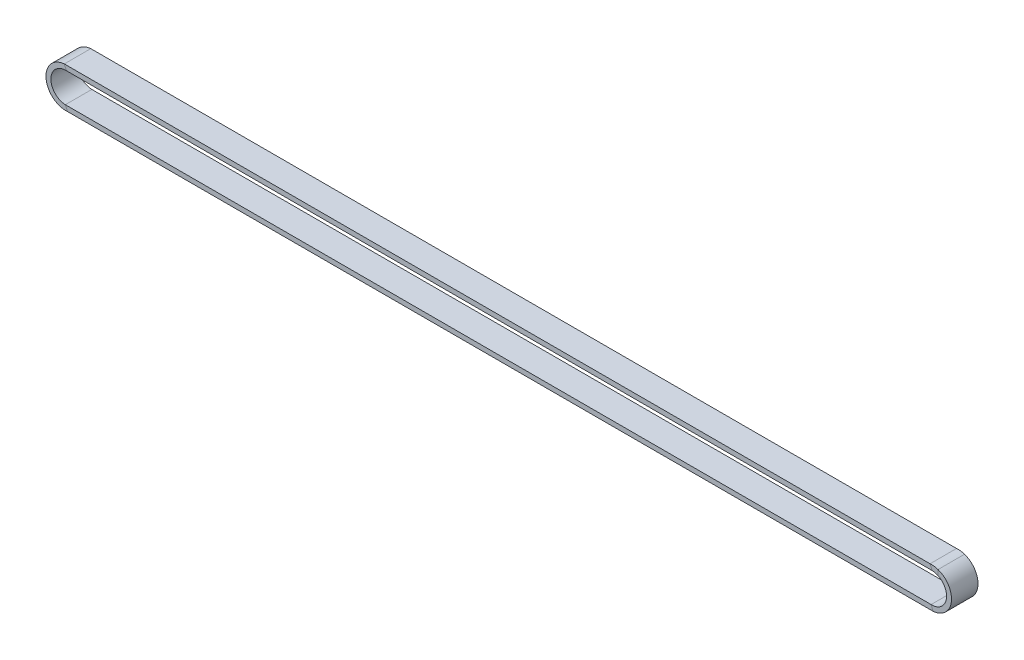
from build123d import *

# Parameters (mm, degrees)
SKETCH3_W = 10
SKETCH3_H = 2


with BuildPart() as part:
    # Sweep1: sweep along a path in Sketch2
    with BuildLine(Plane.XY) as sweep1_path:
        Line((-2.424777961, 21.387796899), (-329.424777961, 21.387796899))
        ThreePointArc((-329.424777961, 21.387796899), (-335.536981062, 27.5), (-329.424777961, 33.612203101))
        Line((-329.424777961, 33.612203101), (-2.424777961, 33.612203101))
        ThreePointArc((-2.424777961, 33.612203101), (3.68742514, 27.5), (-2.424777961, 21.387796899))
    # Sketch3 → Sweep1 (sweep)
    with BuildSketch(Plane(origin=(0, 0, 0), x_dir=(0, 0, -1), z_dir=(1, 0, 0))):
        with Locations((0, 33.612203101)):
            Rectangle(SKETCH3_W, SKETCH3_H)
    sweep(path=sweep1_path.line)


solid = part.part
